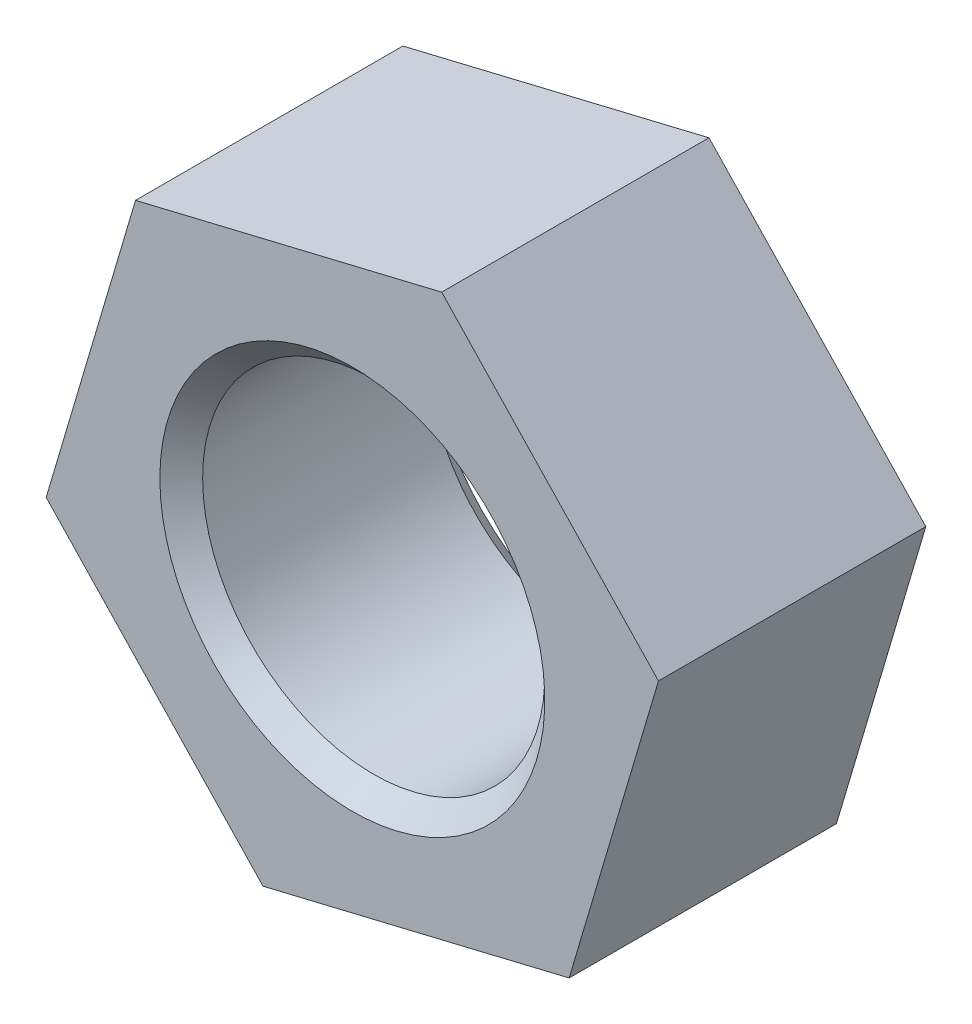
from build123d import *

# Parameters (mm, degrees)
SKETCH1_R       = 4
NUT_DEPTH       = 6.25
CHANFREIN1_SIZE = 0.5


with BuildPart() as part:
    # Sketch1 → NUT (new body)
    with BuildSketch(Plane.XY):
        Polygon((-5.068605871, 5.338233277), (-7.157348565, -1.720424807), (-2.088742694, -7.058658085), (5.068605871, -5.338233277), (7.157348565, 1.720424807), (2.088742694, 7.058658085), align=None)
        Circle(SKETCH1_R, mode=Mode.SUBTRACT)
    extrude(amount=NUT_DEPTH)

    # Chanfrein1
    chanfrein1_edges = [part.edges().sort_by_distance(p)[0] for p in [
        (-4, 0, 0),
        (-4, 0, 6.25),
    ]]
    chamfer(chanfrein1_edges, length=CHANFREIN1_SIZE)


solid = part.part
